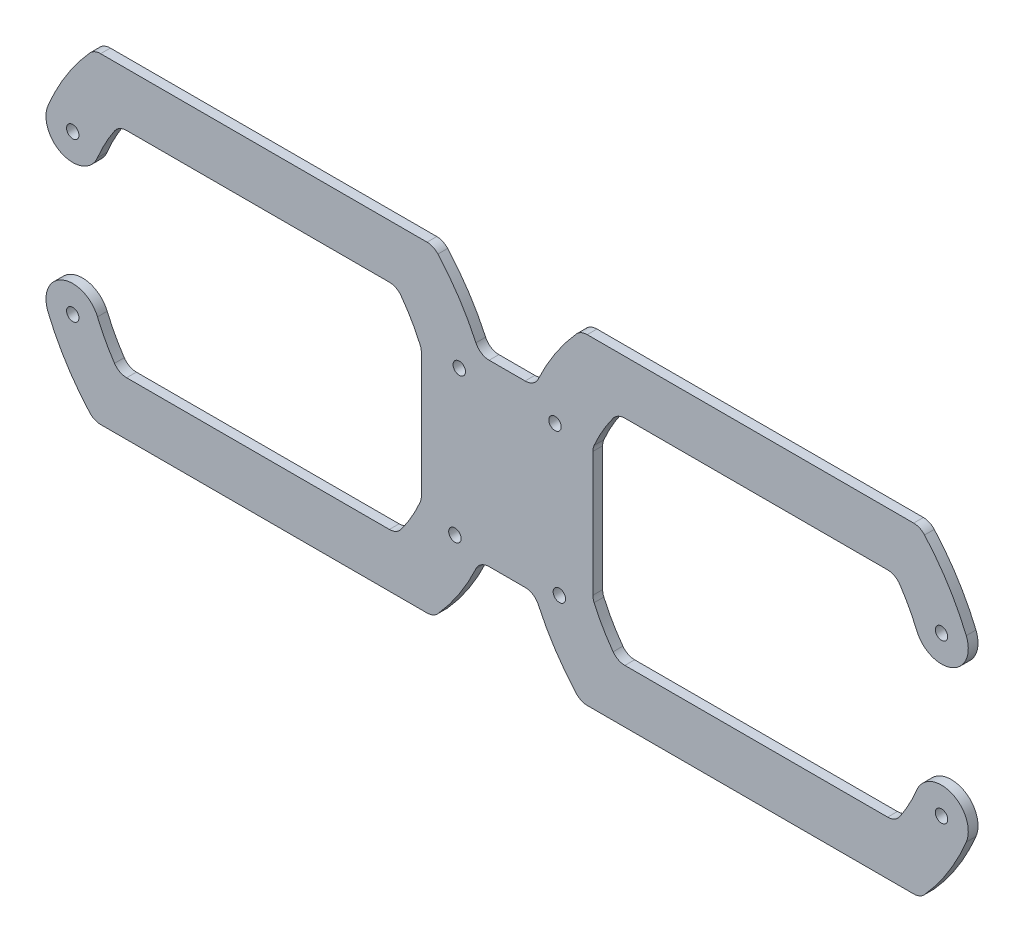
from build123d import *

# Parameters (mm, degrees)
EXTRUDE_1_DEPTH      = 2
HOLE_WIZARD_M2_5_1_D = 2.55
SKETCH_5_OUTSIDE_W   = 241.652
SKETCH_5_OUTSIDE_H   = 141.652
CUT_EXTRUDE_1_DEPTH  = 10
FILLET_1_R           = 3


with BuildPart() as part:
    # 草图1 → 凸台-拉伸1 (new body)
    with BuildSketch(Plane.XY):
        with BuildLine():
            Line((-50, 48), (50, 48))
            ThreePointArc((50, 48), (98, 0), (50, -48))
            Line((50, -48), (-50, -48))
            ThreePointArc((-50, -48), (-98, 0), (-50, 48))
        make_face()
    extrude(amount=EXTRUDE_1_DEPTH)

    # M2.5 螺旋的螺纹孔钻头1 (through all)
    with Locations(Plane(origin=(-89.264880132, 16.264045876, 2), x_dir=(1, 0, 0), z_dir=(0, 0, 1))):
        with Locations((0, 0), (23.000834256, 23.000834256), (55.528926008, 23.000834256), (55.528926008, -55.528926008), (23.000834256, -55.528926008), (0, -32.528091752), (79.433936211, -2.382513767), (78.529760264, -32.528091752), (100, -32.528091752), (99.095824053, -2.382513767), (178.529760264, -32.528091752), (155.528926008, -55.528926008), (123.000834256, -55.528926008), (123.000834256, 23.000834256), (155.528926008, 23.000834256), (178.529760264, 0)):
            Hole(HOLE_WIZARD_M2_5_1_D / 2)

    # 草图5 outside → 切除-拉伸1 (cut)
    with BuildSketch(Plane.XY):
        Rectangle(SKETCH_5_OUTSIDE_W, SKETCH_5_OUTSIDE_H)
        with BuildLine():
            Line((-17.624645737, -13.410310822), (-17.624645737, 13.410310822))
            ThreePointArc((-17.624645737, 13.410310822), (-19.866504602, 17.8877739), (-22.723636606, 22))
            Line((-22.723636606, 22), (-50, 22))
            Line((-50, 22), (-79.748949561, 22))
            ThreePointArc((-79.748949561, 22), (-82.205746178, 18.215101238), (-84.183542703, 14.159286998))
            ThreePointArc((-84.183542703, 14.159286998), (-91.36963901, 11.182708447), (-94.346217561, 18.368804754))
            ThreePointArc((-94.346217561, 18.368804754), (-90.27157125, 26.118969143), (-84.856850116, 33))
            Line((-84.856850116, 33), (-50, 33))
            Line((-50, 33), (-15.143149884, 33))
            ThreePointArc((-15.143149884, 33), (-9.72842875, 26.118969143), (-5.653782439, 18.368804754))
            Line((-5.653782439, 18.368804754), (5.653782439, 18.368804754))
            ThreePointArc((5.653782439, 18.368804754), (9.72842875, 26.118969143), (15.143149884, 33))
            Line((15.143149884, 33), (50, 33))
            Line((50, 33), (84.856850116, 33))
            ThreePointArc((84.856850116, 33), (90.27157125, 26.118969143), (94.346217561, 18.368804754))
            ThreePointArc((94.346217561, 18.368804754), (91.36963901, 11.182708447), (84.183542703, 14.159286998))
            ThreePointArc((84.183542703, 14.159286998), (82.205746178, 18.215101238), (79.748949561, 22))
            Line((79.748949561, 22), (50, 22))
            Line((50, 22), (22.723636606, 22))
            ThreePointArc((22.723636606, 22), (19.866504602, 17.8877739), (17.624645737, 13.410310822))
            Line((17.624645737, 13.410310822), (17.624645737, -13.410310822))
            ThreePointArc((17.624645737, -13.410310822), (19.866504602, -17.8877739), (22.723636606, -22))
            Line((22.723636606, -22), (50, -22))
            Line((50, -22), (79.748949561, -22))
            ThreePointArc((79.748949561, -22), (82.205746178, -18.215101238), (84.183542703, -14.159286998))
            ThreePointArc((84.183542703, -14.159286998), (91.36963901, -11.182708447), (94.346217561, -18.368804754))
            ThreePointArc((94.346217561, -18.368804754), (90.27157125, -26.118969143), (84.856850116, -33))
            Line((84.856850116, -33), (50, -33))
            Line((50, -33), (15.143149884, -33))
            ThreePointArc((15.143149884, -33), (9.72842875, -26.118969143), (5.653782439, -18.368804754))
            Line((5.653782439, -18.368804754), (-5.653782439, -18.368804754))
            ThreePointArc((-5.653782439, -18.368804754), (-9.72842875, -26.118969143), (-15.143149884, -33))
            Line((-15.143149884, -33), (-50, -33))
            Line((-50, -33), (-84.856850116, -33))
            ThreePointArc((-84.856850116, -33), (-90.27157125, -26.118969143), (-94.346217561, -18.368804754))
            ThreePointArc((-94.346217561, -18.368804754), (-91.36963901, -11.182708447), (-84.183542703, -14.159286998))
            ThreePointArc((-84.183542703, -14.159286998), (-82.205746178, -18.215101238), (-79.748949561, -22))
            Line((-79.748949561, -22), (-50, -22))
            Line((-50, -22), (-22.723636606, -22))
            ThreePointArc((-22.723636606, -22), (-19.866504602, -17.8877739), (-17.624645737, -13.410310822))
        make_face(mode=Mode.SUBTRACT)
    extrude(amount=CUT_EXTRUDE_1_DEPTH, mode=Mode.SUBTRACT)

    # 圆角1
    fillet_1_edges = [part.edges().sort_by_distance(p)[0] for p in [
        (5.653782439, 18.368804754, 1),
        (-5.653782439, 18.368804754, 1),
        (-15.143149884, 33, 1),
        (-84.856850116, 33, 1),
        (-79.748949561, 22, 1),
        (-22.723636606, 22, 1),
        (-17.624645737, 13.410310822, 1),
        (-17.624645737, -13.410310822, 1),
        (-22.723636606, -22, 1),
        (-79.748949561, -22, 1),
        (-84.856850116, -33, 1),
        (-15.143149884, -33, 1),
        (-5.653782439, -18.368804754, 1),
        (5.653782439, -18.368804754, 1),
        (15.143149884, -33, 1),
        (84.856850116, -33, 1),
        (79.748949561, -22, 1),
        (22.723636606, -22, 1),
        (17.624645737, -13.410310822, 1),
        (17.624645737, 13.410310822, 1),
        (22.723636606, 22, 1),
        (79.748949561, 22, 1),
        (84.856850116, 33, 1),
        (15.143149884, 33, 1),
    ]]
    fillet(fillet_1_edges, radius=FILLET_1_R)


solid = part.part
